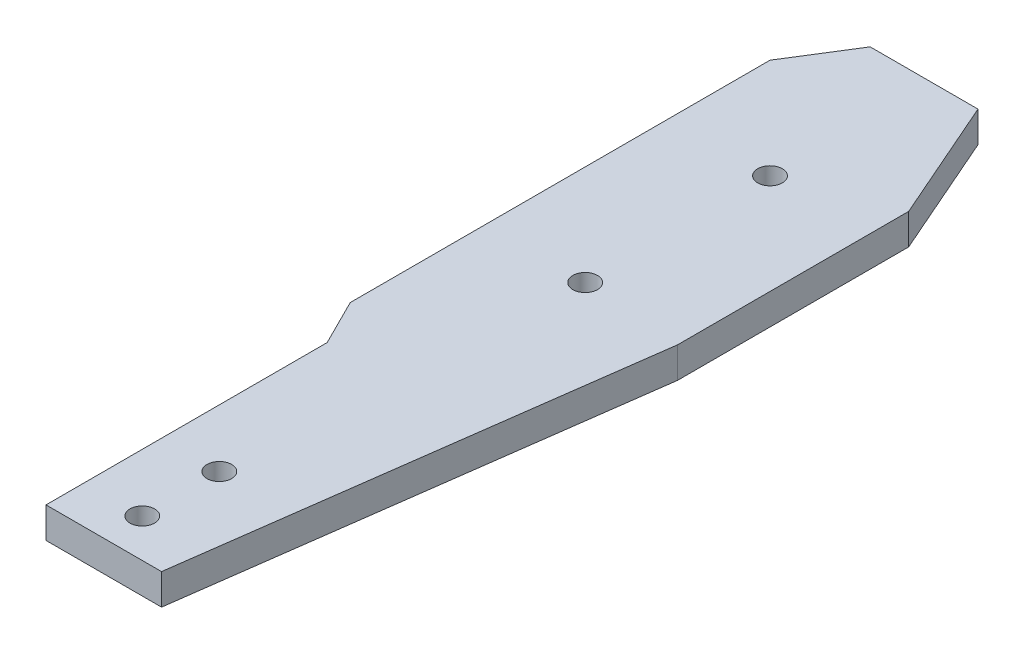
from build123d import *

# Parameters (mm, degrees)
BOSS_EXTRUDE1_DEPTH = 4
SKETCH2_R           = 1.6
CUT_EXTRUDE1_DEPTH  = 101.503731274


with BuildPart() as part:
    # Sketch1 → Boss-Extrude1 (new body)
    with BuildSketch(Plane(origin=(0, 0, 0), x_dir=(1, 0, 0), z_dir=(0, 1, 0))):
        Polygon((0, 0), (0, -54.5), (3, -60.5), (3, -97), (18, -97), (26, -38), (26, -8), (19, 8), (5, 8), align=None)
    extrude(amount=BOSS_EXTRUDE1_DEPTH)

    # Sketch2 → Cut-Extrude1 (cut, through all)
    with BuildSketch(Plane(origin=(0, 4, 0), x_dir=(1, 0, 0), z_dir=(0, 1, 0))):
        with Locations(Location((13, -13, 0), (0, 0, 270))):
            Circle(SKETCH2_R)
        with Locations(Location((13, -37, 0), (0, 0, 270))):
            Circle(SKETCH2_R)
        with Locations(Location((10.5, -82, 0), (0, 0, 270))):
            Circle(SKETCH2_R)
        with Locations(Location((10.5, -92, 0), (0, 0, 270))):
            Circle(SKETCH2_R)
    extrude(amount=-CUT_EXTRUDE1_DEPTH, mode=Mode.SUBTRACT)


solid = part.part
